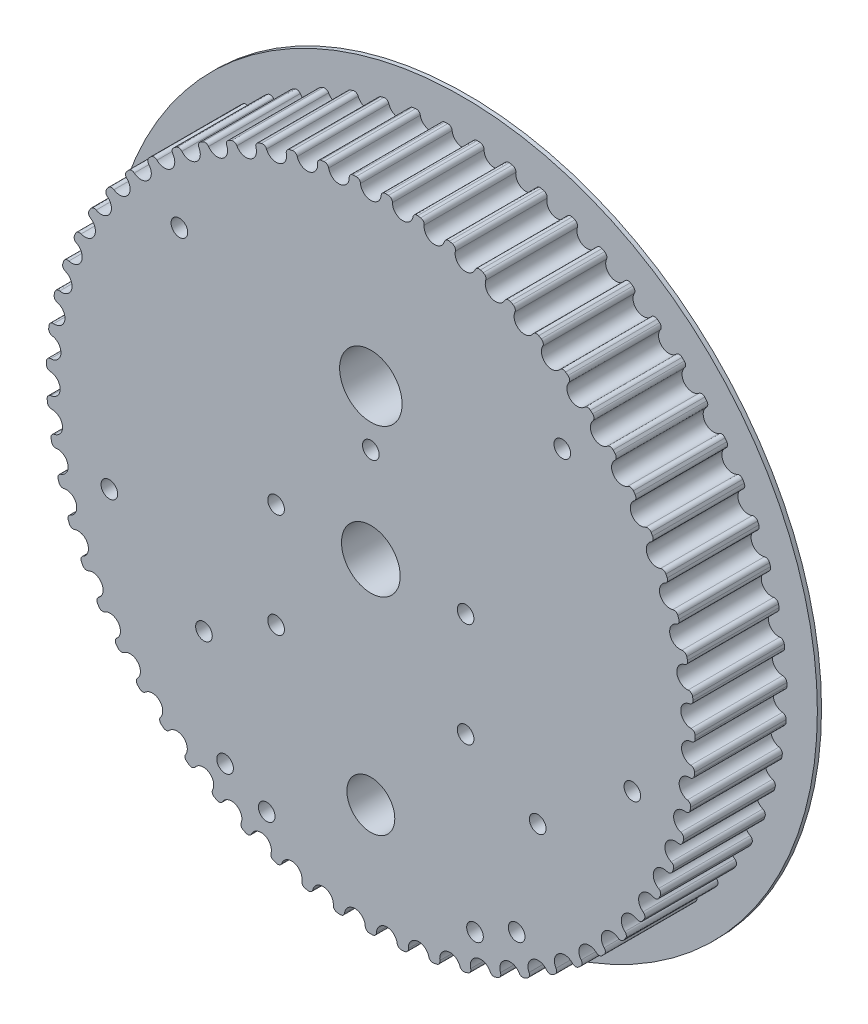
from build123d import *

# Parameters (mm, degrees)
BOSS_EXTRUDE1_DEPTH = 22
SKETCH2_R           = 85.214091318
BOSS_EXTRUDE2_DEPTH = 1
SKETCH3_R           = 7.05
SKETCH3_R_2         = 5.75
SKETCH3_R_3         = 7.5
CUT_EXTRUDE1_DEPTH  = 123.686114611
SKETCH4_R           = 2
CUT_EXTRUDE2_DEPTH  = 18


with BuildPart() as part:
    # Sketch1 → Boss-Extrude1 (new body)
    with BuildSketch(Plane.XY):
        with BuildLine():
            ThreePointArc((-2.48146659, 76.908121514), (0, 74.624091318), (2.48146659, 76.908121514))
            ThreePointArc((2.48146659, 76.908121514), (2.817624817, 77.57630379), (3.523265194, 77.824379512))
            ThreePointArc((3.523265194, 77.824379512), (3.703241715, 77.81602306), (3.883198428, 77.807250395))
            ThreePointArc((3.883198428, 77.807250395), (4.063134372, 77.798061565), (4.243048583, 77.788456617))
            ThreePointArc((4.243048583, 77.788456617), (4.920482109, 77.471354546), (5.188440419, 76.773022067))
            ThreePointArc((5.188440419, 76.773022067), (7.430160077, 74.253267445), (10.12671167, 76.278873497))
            ThreePointArc((10.12671167, 76.278873497), (10.527728921, 76.910264875), (11.254563179, 77.08684876))
            ThreePointArc((11.254563179, 77.08684876), (11.432813322, 77.060613959), (11.611002314, 77.033966985))
            ThreePointArc((11.611002314, 77.033966985), (11.789129204, 77.006907981), (11.967193036, 76.979437092))
            ThreePointArc((11.967193036, 76.979437092), (12.609687073, 76.596460174), (12.806782377, 75.874917834))
            ThreePointArc((12.806782377, 75.874917834), (14.786475884, 73.144481241), (17.67131294, 74.891531766))
            ThreePointArc((17.67131294, 74.891531766), (18.133203726, 75.479857193), (18.874008258, 75.583194272))
            ThreePointArc((18.874008258, 75.583194272), (19.048760494, 75.539341854), (19.223410843, 75.495085401))
            ThreePointArc((19.223410843, 75.495085401), (19.397958373, 75.450425149), (19.572402149, 75.405361336))
            ThreePointArc((19.572402149, 75.405361336), (20.173571302, 74.960315769), (20.297844778, 74.22273458))
            ThreePointArc((20.297844778, 74.22273458), (21.995837052, 71.30875232), (25.040288763, 72.759884345))
            ThreePointArc((25.040288763, 72.759884345), (25.558462605, 73.299296781), (26.305874964, 73.328360042))
            ThreePointArc((26.305874964, 73.328360042), (26.475392525, 73.267325833), (26.644768478, 73.205899741))
            ThreePointArc((26.644768478, 73.205899741), (26.814001917, 73.144082094), (26.983091936, 73.081873222))
            ThreePointArc((26.983091936, 73.081873222), (27.536961516, 72.579182069), (27.587178078, 71.832892444))
            ThreePointArc((27.587178078, 71.832892444), (28.986593708, 68.764324982), (32.160402946, 69.905116505))
            ThreePointArc((32.160402946, 69.905116505), (32.729710001, 70.390255026), (33.476302066, 70.344755626))
            ThreePointArc((33.476302066, 70.344755626), (33.638900212, 70.267146211), (33.801318434, 70.18916096))
            ThreePointArc((33.801318434, 70.18916096), (33.963555864, 70.11080029), (34.125611633, 70.032064619))
            ThreePointArc((34.125611633, 70.032064619), (34.626677035, 69.476723849), (34.602337609, 68.729142751))
            ThreePointArc((34.602337609, 68.729142751), (35.689268574, 65.536486889), (38.960892596, 66.355600211))
            ThreePointArc((38.960892596, 66.355600211), (39.575674834, 66.781643292), (40.314026638, 66.662033425))
            ThreePointArc((40.314026638, 66.662033425), (40.468089395, 66.568620121), (40.621935701, 66.474850764))
            ThreePointArc((40.621935701, 66.474850764), (40.775564733, 66.380725854), (40.92897567, 66.286245894))
            ThreePointArc((40.92897567, 66.286245894), (41.37225708, 65.683774735), (41.273603563, 64.942331958))
            ThreePointArc((41.273603563, 64.942331958), (42.037247454, 61.657317745), (45.374171391, 62.146612151))
            ThreePointArc((45.374171391, 62.146612151), (46.02831883, 62.509325584), (46.751092302, 62.316793986))
            ThreePointArc((46.751092302, 62.316793986), (46.895088524, 62.208505178), (47.03883392, 62.099883635))
            ThreePointArc((47.03883392, 62.099883635), (47.182327721, 61.990929941), (47.325569158, 61.881644677))
            ThreePointArc((47.325569158, 61.881644677), (47.706661048, 61.238030757), (47.534673901, 60.510095095))
            ThreePointArc((47.534673901, 60.510095095), (47.967441284, 57.165370477), (51.336501286, 57.319983138))
            ThreePointArc((51.336501286, 57.319983138), (52.023512715, 57.615762115), (52.723524606, 57.352222252))
            ThreePointArc((52.723524606, 57.352222252), (52.856023196, 57.230134161), (52.988239076, 57.107739964))
            ThreePointArc((52.988239076, 57.107739964), (53.120171538, 56.985040316), (53.251819879, 56.862035874))
            ThreePointArc((53.251819879, 56.862035874), (53.566934785, 56.183675717), (53.323323294, 55.47648172))
            ThreePointArc((53.323323294, 55.47648172), (53.420913131, 52.105288075), (56.788625967, 51.923682381))
            ThreePointArc((56.788625967, 51.923682381), (57.501673558, 52.149587317), (58.171966836, 51.817658367))
            ThreePointArc((58.171966836, 51.817658367), (58.291650962, 51.682984359), (58.411023305, 51.548033916))
            ThreePointArc((58.411023305, 51.548033916), (58.530083226, 51.412807759), (58.648830088, 51.277306612))
            ThreePointArc((58.648830088, 51.277306612), (58.894836258, 50.570942066), (58.582021544, 49.891518147))
            ThreePointArc((58.582021544, 49.891518147), (58.343463943, 46.52735991), (61.67635977, 46.011340741))
            ThreePointArc((61.67635977, 46.011340741), (62.408356935, 46.165126492), (63.042269924, 45.768107312))
            ThreePointArc((63.042269924, 45.768107312), (63.147950112, 45.622185839), (63.253292542, 45.476020348))
            ThreePointArc((63.253292542, 45.476020348), (63.35829665, 45.329611621), (63.462961876, 45.18296044))
            ThreePointArc((63.462961876, 45.18296044), (63.637414389, 44.455611673), (63.258505345, 43.810710252))
            ThreePointArc((63.258505345, 43.810710252), (62.686171199, 40.487021939), (65.9511262, 39.641717725))
            ThreePointArc((65.9511262, 39.641717725), (66.694798023, 39.721855898), (67.286030611, 39.263692245))
            ThreePointArc((67.286030611, 39.263692245), (67.376656564, 39.10797354), (67.46692214, 38.952045659))
            ThreePointArc((67.46692214, 38.952045659), (67.556826858, 38.795909436), (67.646370236, 38.639565707))
            ThreePointArc((67.646370236, 38.639565707), (67.747535305, 37.898461439), (67.306297699, 37.294491835))
            ThreePointArc((67.306297699, 37.294491835), (66.405875122, 34.044305755), (69.570440708, 32.878117508))
            ThreePointArc((69.570440708, 32.878117508), (70.318396244, 32.883811655), (70.861072497, 32.369056964))
            ThreePointArc((70.861072497, 32.369056964), (70.935743532, 32.20508863), (71.010035156, 32.04094804))
            ThreePointArc((71.010035156, 32.04094804), (71.083946969, 31.876636074), (71.157478577, 31.712153611))
            ThreePointArc((71.157478577, 31.712153611), (71.184350778, 30.964659268), (70.685169829, 30.407624003))
            ThreePointArc((70.685169829, 30.407624003), (69.465607625, 27.263241965), (72.498332921, 25.787759789))
            ThreePointArc((72.498332921, 25.787759789), (73.243138652, 25.718953318), (73.731865208, 25.152723453))
            ThreePointArc((73.731865208, 25.152723453), (73.789839212, 24.98213508), (73.847418539, 24.811413085))
            ThreePointArc((73.847418539, 24.811413085), (73.904602879, 24.640558382), (73.961391928, 24.469571885))
            ThreePointArc((73.961391928, 24.469571885), (73.913704193, 23.723116402), (73.361540984, 23.218551543))
            ThreePointArc((73.361540984, 23.218551543), (71.83495971, 20.211223827), (74.70570413, 18.441111727))
            ThreePointArc((74.70570413, 18.441111727), (75.439957841, 18.298488468), (75.869877517, 17.686410876))
            ThreePointArc((75.869877517, 17.686410876), (75.910578319, 17.510897847), (75.950873099, 17.335291159))
            ThreePointArc((75.950873099, 17.335291159), (75.990761643, 17.15959175), (76.030243737, 16.98380056))
            ThreePointArc((76.030243737, 16.98380056), (75.908470008, 16.245802548), (75.308812185, 15.798722686))
            ThreePointArc((75.308812185, 15.798722686), (73.490383692, 12.958337467), (76.170616488, 10.911187612))
            ThreePointArc((76.170616488, 10.911187612), (76.887020837, 10.696165019), (77.253860898, 10.044322801))
            ThreePointArc((77.253860898, 10.044322801), (77.276883994, 9.865629445), (77.299493761, 9.686883322))
            ThreePointArc((77.299493761, 9.686883322), (77.321690077, 9.508085386), (77.343472825, 9.329236595))
            ThreePointArc((77.343472825, 9.329236595), (77.148823344, 8.607030608), (76.507630577, 8.221879025))
            ThreePointArc((76.507630577, 8.221879025), (74.415427224, 5.576665328), (76.878511038, 3.272823212))
            ThreePointArc((76.878511038, 3.272823212), (77.569946077, 2.987538276), (77.870060701, 2.302409734))
            ThreePointArc((77.870060701, 2.302409734), (77.875177277, 2.122311986), (77.879877325, 1.942202886))
            ThreePointArc((77.879877325, 1.942202886), (77.884160817, 1.762083398), (77.888027733, 1.581954485))
            ThreePointArc((77.888027733, 1.581954485), (77.622437014, 0.882718132), (76.946081764, 0.563322636))
            ThreePointArc((76.946081764, 0.563322636), (74.600896808, -1.860430217), (76.822352407, -4.398067976))
            ThreePointArc((76.822352407, -4.398067976), (77.481946343, -4.750779964), (77.712352856, -5.462385715))
            ThreePointArc((77.712352856, -5.462385715), (77.699512062, -5.642097964), (77.686255679, -5.821780035))
            ThreePointArc((77.686255679, -5.821780035), (77.672583776, -6.001430967), (77.658496428, -6.181049799))
            ThreePointArc((77.658496428, -6.181049799), (77.324604031, -6.850367194), (76.619808221, -7.100832306))
            ThreePointArc((76.619808221, -7.100832306), (74.044949163, -9.27903597), (76.002698723, -12.025249187))
            ThreePointArc((76.002698723, -12.025249187), (76.623896215, -12.441882819), (76.782304735, -13.172893522))
            ThreePointArc((76.782304735, -13.172893522), (76.751634188, -13.350434209), (76.720553122, -13.52790349))
            ThreePointArc((76.720553122, -13.52790349), (76.689061702, -13.705300415), (76.657160097, -13.882624034))
            ThreePointArc((76.657160097, -13.882624034), (76.258284394, -14.515370493), (75.532052601, -14.694415986))
            ThreePointArc((75.532052601, -14.694415986), (72.753109547, -16.605422496), (74.427696074, -19.53291807))
            ThreePointArc((74.427696074, -19.53291807), (75.004323383, -20.009332652), (75.089159573, -20.752483194))
            ThreePointArc((75.089159573, -20.752483194), (75.040964091, -20.926087842), (74.99236724, -21.099580563))
            ThreePointArc((74.99236724, -21.099580563), (74.943369278, -21.272960429), (74.893970468, -21.446226513))
            ThreePointArc((74.893970468, -21.446226513), (74.434075667, -22.036113518), (73.693625507, -22.141959958))
            ThreePointArc((73.693625507, -22.141959958), (70.738216844, -23.766776872), (72.112997543, -26.846460038))
            ThreePointArc((72.112997543, -26.846460038), (72.639323888, -27.377920748), (72.649744609, -28.125825364))
            ThreePointArc((72.649744609, -28.125825364), (72.58450318, -28.293768612), (72.51887352, -28.461560525))
            ThreePointArc((72.51887352, -28.461560525), (72.45285598, -28.629200206), (72.386450914, -28.796686759))
            ThreePointArc((72.386450914, -28.796686759), (71.870107654, -29.337851747), (71.122798056, -29.369447185))
            ThreePointArc((71.122798056, -29.369447185), (68.02029596, -30.691926342), (69.081607645, -33.893189824))
            ThreePointArc((69.081607645, -33.893189824), (69.552402157, -34.474414767), (69.488303843, -35.219640447))
            ThreePointArc((69.488303843, -35.219640447), (69.406664866, -35.380253197), (69.324654655, -35.540676711))
            ThreePointArc((69.324654655, -35.540676711), (69.242273649, -35.700910129), (69.159522289, -35.860952594))
            ThreePointArc((69.159522289, -35.860952594), (68.591862222, -36.348017226), (67.845120284, -36.305047651))
            ThreePointArc((67.845120284, -36.305047651), (64.626358816, -37.312045659), (65.363653693, -40.603073863))
            ThreePointArc((65.363653693, -40.603073863), (65.774237406, -41.228286564), (65.636257094, -41.963426919))
            ThreePointArc((65.636257094, -41.963426919), (65.539031934, -42.115112932), (65.441456227, -42.266573685))
            ThreePointArc((65.441456227, -42.266573685), (65.343530494, -42.417808367), (65.24525526, -42.56881617))
            ThreePointArc((65.24525526, -42.56881617), (64.631920047, -42.996939778), (63.893167225, -42.879832242))
            ThreePointArc((63.893167225, -42.879832242), (60.590135883, -43.561341103), (60.996086385, -46.909426312))
            ThreePointArc((60.996086385, -46.909426312), (61.342378733, -47.572413127), (61.131887735, -48.290162002))
            ThreePointArc((61.131887735, -48.290162002), (61.020042658, -48.431413753), (60.907871206, -48.57240646))
            ThreePointArc((60.907871206, -48.57240646), (60.795373976, -48.713139369), (60.682551572, -48.853611727))
            ThreePointArc((60.682551572, -48.853611727), (60.029636814, -49.218539426), (59.306215166, -49.028457797))
            ThreePointArc((59.306215166, -49.028457797), (55.951740959, -49.377704369), (56.022312567, -52.749571807))
            ThreePointArc((56.022312567, -52.749571807), (56.300871941, -53.443743675), (56.01996221, -54.136967759))
            ThreePointArc((56.01996221, -54.136967759), (55.894608784, -54.266381425), (55.768956396, -54.395504838))
            ThreePointArc((55.768956396, -54.395504838), (55.643005719, -54.524337307), (55.516757424, -54.652878142))
            ThreePointArc((55.516757424, -54.652878142), (54.830752081, -54.950983117), (54.129851296, -54.68981651))
            ThreePointArc((54.129851296, -54.68981651), (50.757272496, -54.703329824), (50.491763838, -58.065468359))
            ThreePointArc((50.491763838, -58.065468359), (50.699821789, -58.783926288), (50.351285133, -59.445736009))
            ThreePointArc((50.351285133, -59.445736009), (50.213669176, -59.562025419), (50.075784643, -59.677996251))
            ThreePointArc((50.075784643, -59.677996251), (49.937632271, -59.793647884), (49.799212798, -59.908979701))
            ThreePointArc((49.799212798, -59.908979701), (49.0869347, -60.13729925), (48.415520645, -59.807643257))
            ThreePointArc((48.415520645, -59.807643257), (45.058355455, -59.485289012), (44.459405275, -62.8042842))
            ThreePointArc((44.459405275, -62.8042842), (44.594894031, -63.539887832), (44.182194362, -64.163705827))
            ThreePointArc((44.182194362, -64.163705827), (44.033683565, -64.265715244), (43.884937245, -64.367380925))
            ThreePointArc((43.884937245, -64.367380925), (43.735956199, -64.468702325), (43.586741223, -64.569678903))
            ThreePointArc((43.586741223, -64.569678903), (42.855269308, -64.725943885), (42.220014798, -64.331074775))
            ThreePointArc((42.220014798, -64.331074775), (38.911628234, -63.676056672), (37.985189168, -66.918922847))
            ThreePointArc((37.985189168, -66.918922847), (38.04676218, -67.664361424), (37.574001095, -68.24398791))
            ThreePointArc((37.574001095, -68.24398791), (37.416071423, -68.330703519), (37.257941624, -68.41705365))
            ThreePointArc((37.257941624, -68.41705365), (37.099612544, -68.503037839), (36.941085031, -68.588655628))
            ThreePointArc((36.941085031, -68.588655628), (36.197688996, -68.671313011), (35.604907476, -68.21515517))
            ThreePointArc((35.604907476, -68.21515517), (32.378179769, -67.233983073), (31.133459186, -70.368491176))
            ThreePointArc((31.133459186, -70.368491176), (31.120504514, -71.116356192), (30.592380524, -71.646030581))
            ThreePointArc((30.592380524, -71.646030581), (30.426601553, -71.716590564), (30.26065984, -71.786766957))
            ThreePointArc((30.26065984, -71.786766957), (30.094556273, -71.856559387), (29.928291739, -71.925967478))
            ThreePointArc((29.928291739, -71.925967478), (29.180359789, -71.934195776), (28.635942587, -71.421282706))
            ThreePointArc((28.635942587, -71.421282706), (25.522942408, -70.123707945), (23.972310899, -73.118705824))
            ThreePointArc((23.972310899, -73.118705824), (23.884957293, -73.861564663), (23.306719131, -74.336022812))
            ThreePointArc((23.306719131, -74.336022812), (23.134738447, -74.389725911), (22.962634024, -74.443031123))
            ThreePointArc((22.962634024, -74.443031123), (22.79040678, -74.495938164), (22.618057639, -74.54844675))
            ThreePointArc((22.618057639, -74.54844675), (21.873023056, -74.482164185), (21.382380835, -73.917593447))
            ThreePointArc((21.382380835, -73.917593447), (18.414046579, -72.316511902), (16.572915017, -75.142233924))
            ThreePointArc((16.572915017, -75.142233924), (16.412030635, -75.87270372), (15.789425092, -76.287230251))
            ThreePointArc((15.789425092, -76.287230251), (15.612951917, -76.323542741), (15.436395234, -76.359447001))
            ThreePointArc((15.436395234, -76.359447001), (15.259755987, -76.394942839), (15.083035119, -76.430030065))
            ThreePointArc((15.083035119, -76.430030065), (14.348302394, -76.289895384), (13.916311377, -75.679277936))
            ThreePointArc((13.916311377, -75.679277936), (11.122143681, -73.790601875), (9.008810059, -76.418964744))
            ThreePointArc((9.008810059, -76.418964744), (8.775993843, -77.12978576), (8.115208653, -77.480260923))
            ThreePointArc((8.115208653, -77.480260923), (7.935996857, -77.498821914), (7.756742614, -77.516968389))
            ThreePointArc((7.756742614, -77.516968389), (7.577446882, -77.53470025), (7.398110621, -77.552017404))
            ThreePointArc((7.398110621, -77.552017404), (6.680981856, -77.339423328), (6.311935363, -76.68882776))
            ThreePointArc((6.311935363, -76.68882776), (3.719703923, -74.531327694), (1.355171499, -76.93620956))
            ThreePointArc((1.355171499, -76.93620956), (1.052737282, -77.620317337), (0.360339625, -77.903257952))
            ThreePointArc((0.360339625, -77.903257952), (0.180170294, -77.903882976), (0, -77.904091318))
            ThreePointArc((0, -77.904091318), (-0.180170294, -77.903882976), (-0.360339625, -77.903257952))
            ThreePointArc((-0.360339625, -77.903257952), (-1.052737282, -77.620317337), (-1.355171499, -76.93620956))
            ThreePointArc((-1.355171499, -76.93620956), (-3.719703923, -74.531327694), (-6.311935363, -76.68882776))
            ThreePointArc((-6.311935363, -76.68882776), (-6.680981856, -77.339423328), (-7.398110621, -77.552017404))
            ThreePointArc((-7.398110621, -77.552017404), (-7.577446882, -77.53470025), (-7.756742614, -77.516968389))
            ThreePointArc((-7.756742614, -77.516968389), (-7.935996857, -77.498821914), (-8.115208653, -77.480260923))
            ThreePointArc((-8.115208653, -77.480260923), (-8.775993843, -77.12978576), (-9.008810059, -76.418964744))
            ThreePointArc((-9.008810059, -76.418964744), (-11.122143681, -73.790601875), (-13.916311377, -75.679277936))
            ThreePointArc((-13.916311377, -75.679277936), (-14.348302394, -76.289895384), (-15.083035119, -76.430030065))
            ThreePointArc((-15.083035119, -76.430030065), (-15.259755987, -76.394942839), (-15.436395234, -76.359447001))
            ThreePointArc((-15.436395234, -76.359447001), (-15.612951917, -76.323542741), (-15.789425092, -76.287230251))
            ThreePointArc((-15.789425092, -76.287230251), (-16.412030635, -75.87270372), (-16.572915017, -75.142233924))
            ThreePointArc((-16.572915017, -75.142233924), (-18.414046579, -72.316511902), (-21.382380835, -73.917593447))
            ThreePointArc((-21.382380835, -73.917593447), (-21.873023056, -74.482164185), (-22.618057639, -74.54844675))
            ThreePointArc((-22.618057639, -74.54844675), (-22.790406781, -74.495938164), (-22.962634024, -74.443031123))
            ThreePointArc((-22.962634024, -74.443031123), (-23.134738447, -74.389725911), (-23.306719131, -74.336022812))
            ThreePointArc((-23.306719131, -74.336022812), (-23.884957293, -73.861564663), (-23.972310899, -73.118705824))
            ThreePointArc((-23.972310899, -73.118705824), (-25.522942408, -70.123707945), (-28.635942587, -71.421282706))
            ThreePointArc((-28.635942587, -71.421282706), (-29.180359789, -71.934195776), (-29.928291739, -71.925967478))
            ThreePointArc((-29.928291739, -71.925967478), (-30.094556273, -71.856559387), (-30.26065984, -71.786766957))
            ThreePointArc((-30.26065984, -71.786766957), (-30.426601553, -71.716590564), (-30.592380524, -71.646030581))
            ThreePointArc((-30.592380524, -71.646030581), (-31.120504514, -71.116356192), (-31.133459186, -70.368491176))
            ThreePointArc((-31.133459186, -70.368491176), (-32.378179769, -67.233983073), (-35.604907476, -68.21515517))
            ThreePointArc((-35.604907476, -68.21515517), (-36.197688996, -68.671313011), (-36.941085031, -68.588655628))
            ThreePointArc((-36.941085031, -68.588655628), (-37.099612544, -68.503037839), (-37.257941624, -68.41705365))
            ThreePointArc((-37.257941624, -68.41705365), (-37.416071423, -68.330703519), (-37.574001095, -68.24398791))
            ThreePointArc((-37.574001095, -68.24398791), (-38.04676218, -67.664361424), (-37.985189168, -66.918922847))
            ThreePointArc((-37.985189168, -66.918922847), (-38.911628234, -63.676056672), (-42.220014798, -64.331074775))
            ThreePointArc((-42.220014798, -64.331074775), (-42.855269308, -64.725943885), (-43.586741223, -64.569678903))
            ThreePointArc((-43.586741223, -64.569678903), (-43.735956199, -64.468702325), (-43.884937245, -64.367380925))
            ThreePointArc((-43.884937245, -64.367380925), (-44.033683565, -64.265715244), (-44.182194362, -64.163705827))
            ThreePointArc((-44.182194362, -64.163705827), (-44.594894031, -63.539887832), (-44.459405275, -62.8042842))
            ThreePointArc((-44.459405275, -62.8042842), (-45.058355455, -59.485289012), (-48.415520645, -59.807643257))
            ThreePointArc((-48.415520645, -59.807643257), (-49.0869347, -60.13729925), (-49.799212798, -59.908979701))
            ThreePointArc((-49.799212798, -59.908979701), (-49.937632271, -59.793647884), (-50.075784643, -59.677996251))
            ThreePointArc((-50.075784643, -59.677996251), (-50.213669176, -59.562025419), (-50.351285133, -59.445736009))
            ThreePointArc((-50.351285133, -59.445736009), (-50.699821789, -58.783926288), (-50.491763838, -58.065468359))
            ThreePointArc((-50.491763838, -58.065468359), (-50.757272496, -54.703329824), (-54.129851296, -54.68981651))
            ThreePointArc((-54.129851296, -54.68981651), (-54.830752081, -54.950983117), (-55.516757424, -54.652878142))
            ThreePointArc((-55.516757424, -54.652878142), (-55.643005719, -54.524337307), (-55.768956396, -54.395504838))
            ThreePointArc((-55.768956396, -54.395504838), (-55.894608784, -54.266381425), (-56.01996221, -54.136967759))
            ThreePointArc((-56.01996221, -54.136967759), (-56.300871941, -53.443743675), (-56.022312567, -52.749571807))
            ThreePointArc((-56.022312567, -52.749571807), (-55.951740959, -49.377704369), (-59.306215166, -49.028457797))
            ThreePointArc((-59.306215166, -49.028457797), (-60.029636814, -49.218539426), (-60.682551572, -48.853611727))
            ThreePointArc((-60.682551572, -48.853611727), (-60.795373976, -48.713139369), (-60.907871206, -48.57240646))
            ThreePointArc((-60.907871206, -48.57240646), (-61.020042658, -48.431413753), (-61.131887735, -48.290162002))
            ThreePointArc((-61.131887735, -48.290162002), (-61.342378733, -47.572413127), (-60.996086385, -46.909426312))
            ThreePointArc((-60.996086385, -46.909426312), (-60.590135883, -43.561341103), (-63.893167225, -42.879832242))
            ThreePointArc((-63.893167225, -42.879832242), (-64.631920047, -42.996939778), (-65.24525526, -42.56881617))
            ThreePointArc((-65.24525526, -42.56881617), (-65.343530494, -42.417808367), (-65.441456227, -42.266573685))
            ThreePointArc((-65.441456227, -42.266573685), (-65.539031934, -42.115112932), (-65.636257094, -41.963426919))
            ThreePointArc((-65.636257094, -41.963426919), (-65.774237406, -41.228286564), (-65.363653693, -40.603073863))
            ThreePointArc((-65.363653693, -40.603073863), (-64.626358816, -37.312045659), (-67.845120284, -36.305047651))
            ThreePointArc((-67.845120284, -36.305047651), (-68.591862222, -36.348017226), (-69.159522289, -35.860952594))
            ThreePointArc((-69.159522289, -35.860952594), (-69.242273649, -35.700910129), (-69.324654655, -35.540676711))
            ThreePointArc((-69.324654655, -35.540676711), (-69.406664866, -35.380253197), (-69.488303843, -35.219640447))
            ThreePointArc((-69.488303843, -35.219640447), (-69.552402157, -34.474414767), (-69.081607645, -33.893189824))
            ThreePointArc((-69.081607645, -33.893189824), (-68.02029596, -30.691926342), (-71.122798056, -29.369447185))
            ThreePointArc((-71.122798056, -29.369447185), (-71.870107654, -29.337851747), (-72.386450914, -28.796686759))
            ThreePointArc((-72.386450914, -28.796686759), (-72.45285598, -28.629200206), (-72.51887352, -28.461560525))
            ThreePointArc((-72.51887352, -28.461560525), (-72.58450318, -28.293768612), (-72.649744609, -28.125825364))
            ThreePointArc((-72.649744609, -28.125825364), (-72.639323888, -27.377920748), (-72.112997543, -26.846460038))
            ThreePointArc((-72.112997543, -26.846460038), (-70.738216844, -23.766776872), (-73.693625507, -22.141959958))
            ThreePointArc((-73.693625507, -22.141959958), (-74.434075667, -22.036113518), (-74.893970468, -21.446226513))
            ThreePointArc((-74.893970468, -21.446226513), (-74.943369278, -21.272960429), (-74.99236724, -21.099580563))
            ThreePointArc((-74.99236724, -21.099580563), (-75.040964091, -20.926087842), (-75.089159573, -20.752483194))
            ThreePointArc((-75.089159573, -20.752483194), (-75.004323383, -20.009332652), (-74.427696074, -19.53291807))
            ThreePointArc((-74.427696074, -19.53291807), (-72.753109547, -16.605422496), (-75.532052601, -14.694415986))
            ThreePointArc((-75.532052601, -14.694415986), (-76.258284394, -14.515370493), (-76.657160097, -13.882624034))
            ThreePointArc((-76.657160097, -13.882624034), (-76.689061702, -13.705300415), (-76.720553122, -13.52790349))
            ThreePointArc((-76.720553122, -13.52790349), (-76.751634188, -13.350434209), (-76.782304735, -13.172893522))
            ThreePointArc((-76.782304735, -13.172893522), (-76.623896215, -12.441882819), (-76.002698723, -12.025249187))
            ThreePointArc((-76.002698723, -12.025249187), (-74.044949163, -9.27903597), (-76.619808221, -7.100832306))
            ThreePointArc((-76.619808221, -7.100832306), (-77.324604031, -6.850367194), (-77.658496428, -6.181049799))
            ThreePointArc((-77.658496428, -6.181049799), (-77.672583776, -6.001430967), (-77.686255679, -5.821780035))
            ThreePointArc((-77.686255679, -5.821780035), (-77.699512062, -5.642097964), (-77.712352856, -5.462385715))
            ThreePointArc((-77.712352856, -5.462385715), (-77.481946343, -4.750779964), (-76.822352407, -4.398067976))
            ThreePointArc((-76.822352407, -4.398067976), (-74.600896808, -1.860430217), (-76.946081764, 0.563322636))
            ThreePointArc((-76.946081764, 0.563322636), (-77.622437014, 0.882718132), (-77.888027733, 1.581954485))
            ThreePointArc((-77.888027733, 1.581954485), (-77.884160817, 1.762083398), (-77.879877325, 1.942202886))
            ThreePointArc((-77.879877325, 1.942202886), (-77.875177277, 2.122311986), (-77.870060701, 2.302409734))
            ThreePointArc((-77.870060701, 2.302409734), (-77.569946077, 2.987538276), (-76.878511038, 3.272823212))
            ThreePointArc((-76.878511038, 3.272823212), (-74.415427224, 5.576665328), (-76.507630577, 8.221879025))
            ThreePointArc((-76.507630577, 8.221879025), (-77.148823344, 8.607030608), (-77.343472825, 9.329236595))
            ThreePointArc((-77.343472825, 9.329236595), (-77.321690077, 9.508085386), (-77.299493761, 9.686883322))
            ThreePointArc((-77.299493761, 9.686883322), (-77.276883994, 9.865629445), (-77.253860898, 10.044322801))
            ThreePointArc((-77.253860898, 10.044322801), (-76.887020837, 10.696165019), (-76.170616488, 10.911187612))
            ThreePointArc((-76.170616488, 10.911187612), (-73.490383692, 12.958337467), (-75.308812185, 15.798722686))
            ThreePointArc((-75.308812185, 15.798722686), (-75.908470008, 16.245802548), (-76.030243737, 16.98380056))
            ThreePointArc((-76.030243737, 16.98380056), (-75.990761643, 17.15959175), (-75.950873099, 17.335291159))
            ThreePointArc((-75.950873099, 17.335291159), (-75.910578319, 17.510897847), (-75.869877517, 17.686410876))
            ThreePointArc((-75.869877517, 17.686410876), (-75.439957841, 18.298488468), (-74.70570413, 18.441111727))
            ThreePointArc((-74.70570413, 18.441111727), (-71.83495971, 20.211223827), (-73.361540984, 23.218551543))
            ThreePointArc((-73.361540984, 23.218551543), (-73.913704193, 23.723116402), (-73.961391928, 24.469571885))
            ThreePointArc((-73.961391928, 24.469571885), (-73.904602879, 24.640558382), (-73.847418539, 24.811413085))
            ThreePointArc((-73.847418539, 24.811413085), (-73.789839212, 24.98213508), (-73.731865208, 25.152723453))
            ThreePointArc((-73.731865208, 25.152723453), (-73.243138652, 25.718953318), (-72.498332921, 25.787759789))
            ThreePointArc((-72.498332921, 25.787759789), (-69.465607625, 27.263241965), (-70.685169829, 30.407624003))
            ThreePointArc((-70.685169829, 30.407624003), (-71.184350778, 30.964659268), (-71.157478577, 31.712153611))
            ThreePointArc((-71.157478577, 31.712153611), (-71.083946969, 31.876636074), (-71.010035156, 32.04094804))
            ThreePointArc((-71.010035156, 32.04094804), (-70.935743532, 32.20508863), (-70.861072497, 32.369056964))
            ThreePointArc((-70.861072497, 32.369056964), (-70.318396244, 32.883811655), (-69.570440708, 32.878117508))
            ThreePointArc((-69.570440708, 32.878117508), (-66.405875122, 34.044305755), (-67.306297699, 37.294491835))
            ThreePointArc((-67.306297699, 37.294491835), (-67.747535305, 37.898461439), (-67.646370236, 38.639565707))
            ThreePointArc((-67.646370236, 38.639565707), (-67.556826858, 38.795909436), (-67.46692214, 38.952045659))
            ThreePointArc((-67.46692214, 38.952045659), (-67.376656564, 39.10797354), (-67.286030611, 39.263692245))
            ThreePointArc((-67.286030611, 39.263692245), (-66.694798023, 39.721855898), (-65.9511262, 39.641717725))
            ThreePointArc((-65.9511262, 39.641717725), (-62.686171199, 40.487021939), (-63.258505345, 43.810710252))
            ThreePointArc((-63.258505345, 43.810710252), (-63.637414389, 44.455611673), (-63.462961876, 45.18296044))
            ThreePointArc((-63.462961876, 45.18296044), (-63.35829665, 45.329611621), (-63.253292542, 45.476020348))
            ThreePointArc((-63.253292542, 45.476020348), (-63.147950112, 45.622185839), (-63.042269924, 45.768107312))
            ThreePointArc((-63.042269924, 45.768107312), (-62.408356935, 46.165126492), (-61.67635977, 46.011340741))
            ThreePointArc((-61.67635977, 46.011340741), (-58.343463943, 46.52735991), (-58.582021544, 49.891518147))
            ThreePointArc((-58.582021544, 49.891518147), (-58.894836258, 50.570942066), (-58.648830088, 51.277306612))
            ThreePointArc((-58.648830088, 51.277306612), (-58.530083226, 51.412807759), (-58.411023305, 51.548033916))
            ThreePointArc((-58.411023305, 51.548033916), (-58.291650962, 51.682984359), (-58.171966836, 51.817658367))
            ThreePointArc((-58.171966836, 51.817658367), (-57.501673558, 52.149587317), (-56.788625967, 51.923682381))
            ThreePointArc((-56.788625967, 51.923682381), (-53.420913131, 52.105288075), (-53.323323294, 55.47648172))
            ThreePointArc((-53.323323294, 55.47648172), (-53.566934785, 56.183675717), (-53.251819879, 56.862035874))
            ThreePointArc((-53.251819879, 56.862035874), (-53.120171538, 56.985040316), (-52.988239076, 57.107739964))
            ThreePointArc((-52.988239076, 57.107739964), (-52.856023196, 57.230134161), (-52.723524606, 57.352222252))
            ThreePointArc((-52.723524606, 57.352222252), (-52.023512715, 57.615762115), (-51.336501286, 57.319983138))
            ThreePointArc((-51.336501286, 57.319983138), (-47.967441284, 57.165370477), (-47.534673901, 60.510095095))
            ThreePointArc((-47.534673901, 60.510095095), (-47.706661048, 61.238030757), (-47.325569158, 61.881644677))
            ThreePointArc((-47.325569158, 61.881644677), (-47.182327721, 61.990929941), (-47.03883392, 62.099883635))
            ThreePointArc((-47.03883392, 62.099883635), (-46.895088524, 62.208505178), (-46.751092302, 62.316793986))
            ThreePointArc((-46.751092302, 62.316793986), (-46.02831883, 62.509325584), (-45.374171391, 62.146612151))
            ThreePointArc((-45.374171391, 62.146612151), (-42.037247454, 61.657317745), (-41.273603563, 64.942331958))
            ThreePointArc((-41.273603563, 64.942331958), (-41.37225708, 65.683774735), (-40.92897567, 66.286245894))
            ThreePointArc((-40.92897567, 66.286245894), (-40.775564733, 66.380725854), (-40.621935701, 66.474850764))
            ThreePointArc((-40.621935701, 66.474850764), (-40.468089395, 66.568620121), (-40.314026638, 66.662033425))
            ThreePointArc((-40.314026638, 66.662033425), (-39.575674834, 66.781643292), (-38.960892596, 66.355600211))
            ThreePointArc((-38.960892596, 66.355600211), (-35.689268574, 65.536486889), (-34.602337609, 68.729142751))
            ThreePointArc((-34.602337609, 68.729142751), (-34.626677035, 69.476723849), (-34.125611633, 70.032064619))
            ThreePointArc((-34.125611633, 70.032064619), (-33.963555864, 70.11080029), (-33.801318434, 70.18916096))
            ThreePointArc((-33.801318434, 70.18916096), (-33.638900212, 70.267146211), (-33.476302066, 70.344755626))
            ThreePointArc((-33.476302066, 70.344755626), (-32.729710001, 70.390255026), (-32.160402946, 69.905116505))
            ThreePointArc((-32.160402946, 69.905116505), (-28.986593708, 68.764324982), (-27.587178078, 71.832892444))
            ThreePointArc((-27.587178078, 71.832892444), (-27.536961516, 72.579182069), (-26.983091936, 73.081873222))
            ThreePointArc((-26.983091936, 73.081873222), (-26.814001917, 73.144082094), (-26.644768478, 73.205899741))
            ThreePointArc((-26.644768478, 73.205899741), (-26.475392525, 73.267325833), (-26.305874964, 73.328360042))
            ThreePointArc((-26.305874964, 73.328360042), (-25.558462605, 73.299296781), (-25.040288763, 72.759884345))
            ThreePointArc((-25.040288763, 72.759884345), (-21.995837052, 71.30875232), (-20.297844778, 74.22273458))
            ThreePointArc((-20.297844778, 74.22273458), (-20.173571302, 74.960315769), (-19.572402149, 75.405361336))
            ThreePointArc((-19.572402149, 75.405361336), (-19.397958373, 75.450425149), (-19.223410843, 75.495085401))
            ThreePointArc((-19.223410843, 75.495085401), (-19.048760494, 75.539341854), (-18.874008258, 75.583194272))
            ThreePointArc((-18.874008258, 75.583194272), (-18.133203726, 75.479857193), (-17.67131294, 74.891531766))
            ThreePointArc((-17.67131294, 74.891531766), (-14.786475884, 73.144481241), (-12.806782377, 75.874917834))
            ThreePointArc((-12.806782377, 75.874917834), (-12.609687073, 76.596460174), (-11.967193036, 76.979437092))
            ThreePointArc((-11.967193036, 76.979437092), (-11.789129204, 77.006907981), (-11.611002314, 77.033966985))
            ThreePointArc((-11.611002314, 77.033966985), (-11.432813322, 77.060613959), (-11.254563179, 77.08684876))
            ThreePointArc((-11.254563179, 77.08684876), (-10.527728921, 76.910264875), (-10.12671167, 76.278873497))
            ThreePointArc((-10.12671167, 76.278873497), (-7.430160077, 74.253267445), (-5.188440419, 76.773022067))
            ThreePointArc((-5.188440419, 76.773022067), (-4.920482109, 77.471354546), (-4.243048583, 77.788456617))
            ThreePointArc((-4.243048583, 77.788456617), (-4.063134372, 77.798061565), (-3.883198428, 77.807250395))
            ThreePointArc((-3.883198428, 77.807250395), (-3.703241715, 77.81602306), (-3.523265194, 77.824379512))
            ThreePointArc((-3.523265194, 77.824379512), (-2.817624817, 77.57630379), (-2.48146659, 76.908121514))
        make_face()
    extrude(amount=BOSS_EXTRUDE1_DEPTH)

    # Sketch2 → Boss-Extrude2 (add)
    with BuildSketch(Plane(origin=(0, 0, 0), x_dir=(-1, 0, 0), z_dir=(0, 0, -1))):
        Circle(SKETCH2_R)
    extrude(amount=BOSS_EXTRUDE2_DEPTH)

    # Sketch3 → Cut-Extrude1 (cut, through all)
    with BuildSketch(Plane.XY.offset(22)):
        Circle(SKETCH3_R)
        with Locations((0, -51.05)):
            Circle(SKETCH3_R_2)
        with Locations((0, 36)):
            Circle(SKETCH3_R_3)
    extrude(amount=-CUT_EXTRUDE1_DEPTH, mode=Mode.SUBTRACT)

    # Sketch4 → Cut-Extrude2 (cut)
    with BuildSketch(Plane.XY.offset(22)):
        with Locations((-45.961940777, 45.961940777)):
            Circle(SKETCH4_R)
        with Locations((45.961940777, 45.961940777)):
            Circle(SKETCH4_R)
        with Locations((-25, -65)):
            Circle(SKETCH4_R)
        with Locations((25, -65)):
            Circle(SKETCH4_R)
        with Locations((-62.785178709, -16.823237932)):
            Circle(SKETCH4_R)
        with Locations((62.785178709, -16.823237932)):
            Circle(SKETCH4_R)
        with Locations((-35, -60)):
            Circle(SKETCH4_R)
        with Locations((35, -60)):
            Circle(SKETCH4_R)
        with Locations((-22.75, 0)):
            Circle(SKETCH4_R)
        with Locations((22.75, 0)):
            Circle(SKETCH4_R)
        with Locations((0, 22.75)):
            Circle(SKETCH4_R)
        with Locations((-22.75, -25)):
            Circle(SKETCH4_R)
        with Locations((22.75, -25)):
            Circle(SKETCH4_R)
        with Locations((-40.070508076, -35)):
            Circle(SKETCH4_R)
        with Locations((40.070508076, -35)):
            Circle(SKETCH4_R)
    extrude(amount=-CUT_EXTRUDE2_DEPTH, mode=Mode.SUBTRACT)


solid = part.part
